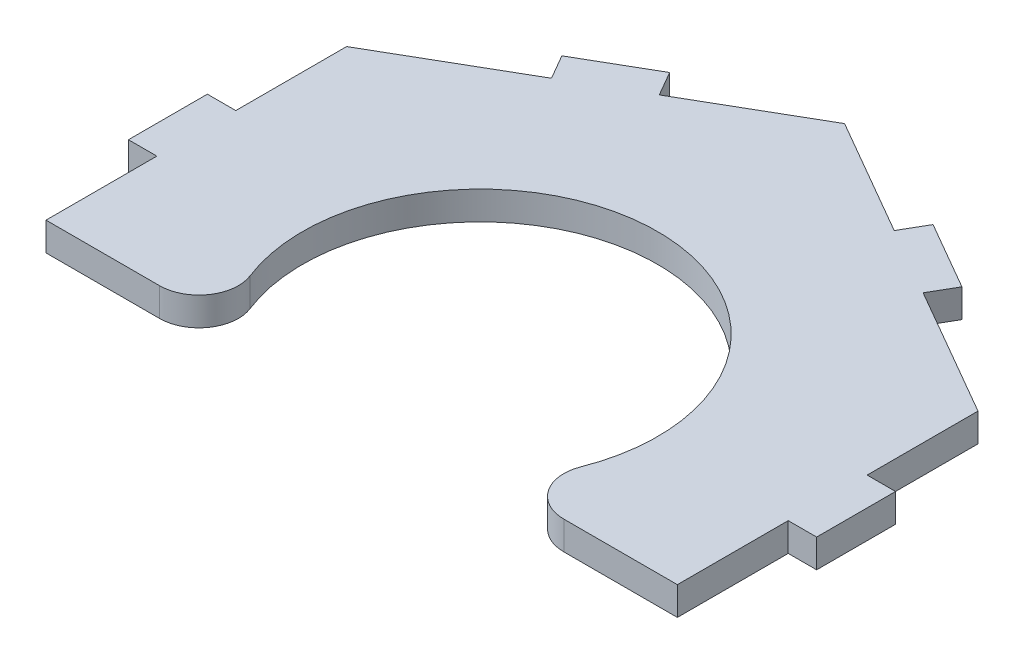
from build123d import *

# Parameters (mm, degrees)
BOSS_EXTRUDE1_DEPTH = 4.572
SKETCH2_W           = 4.572
SKETCH2_H           = 12.7
BOSS_EXTRUDE2_DEPTH = 4.572


with BuildPart() as part:
    # Sketch1 → Boss-Extrude1 (new body)
    with BuildSketch(Plane(origin=(0, 0, 0), x_dir=(1, 0, 0), z_dir=(0, 1, 0))):
        with BuildLine():
            Line((-50.8, -19.05), (-32.534068682, -19.05))
            ThreePointArc((-32.534068682, -19.05), (-27.290728751, -16.281883075), (-26.618783467, -10.390909091))
            ThreePointArc((-26.618783467, -10.390909091), (0, 28.575), (26.618783467, -10.390909091))
            ThreePointArc((26.618783467, -10.390909091), (27.290728751, -16.281883075), (32.534068682, -19.05))
            Line((32.534068682, -19.05), (50.8, -19.05))
            Line((50.8, -19.05), (50.8, 29.329393675))
            Line((50.8, 29.329393675), (0, 58.65878735))
            Line((0, 58.65878735), (-50.8, 29.329393675))
            Line((-50.8, 29.329393675), (-50.8, -19.05))
        make_face()
    extrude(amount=BOSS_EXTRUDE1_DEPTH)

    # Sketch2 → Boss-Extrude2 (add)
    with BuildSketch(Plane(origin=(0, 4.572, 0), x_dir=(1, 0, 0), z_dir=(0, 1, 0))):
        with Locations((-53.086, 5.139696837)):
            Rectangle(SKETCH2_W, SKETCH2_H)
        Polygon((-29.902807007, 41.394393675), (-32.188807007, 45.353861821), (-21.190284379, 51.703861821), (-18.904284379, 47.744393675), align=None)
        Polygon((18.904284379, 47.744393675), (21.190284379, 51.703861821), (32.188807007, 45.353861821), (29.902807007, 41.394393675), align=None)
        with Locations((53.086, 5.139696837)):
            Rectangle(SKETCH2_W, SKETCH2_H)
    extrude(amount=-BOSS_EXTRUDE2_DEPTH)


solid = part.part
